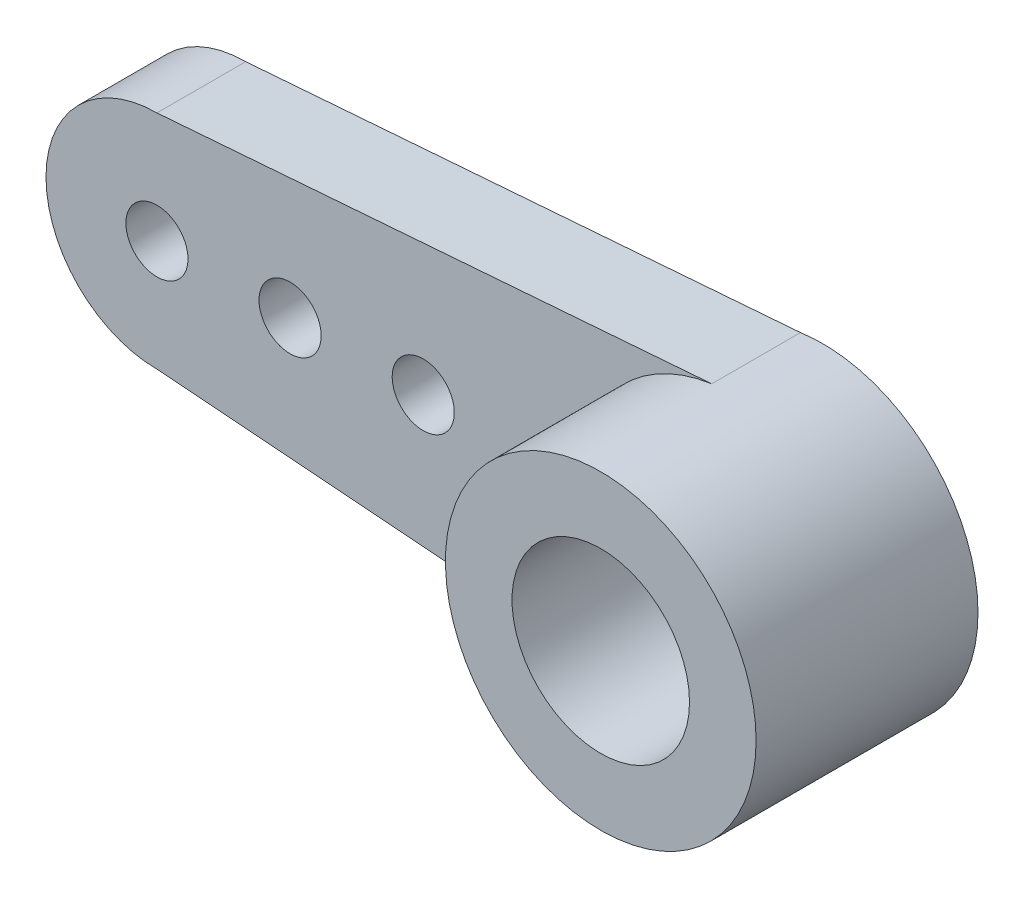
from build123d import *

# Parameters (mm, degrees)
SKETCH1_R           = 3.5
SKETCH1_R_2         = 2
BOSS_EXTRUDE1_DEPTH = 5
SKETCH2_R           = 2
SKETCH2_R_2         = 0.7
BOSS_EXTRUDE2_DEPTH = 2


with BuildPart() as part:
    # Sketch1 → Boss-Extrude1 (new body)
    with BuildSketch(Plane.XY):
        Circle(SKETCH1_R)
        Circle(SKETCH1_R_2, mode=Mode.SUBTRACT)
    extrude(amount=BOSS_EXTRUDE1_DEPTH)

    # Sketch2 → Boss-Extrude2 (add)
    with BuildSketch(Plane(origin=(0, 0, 0), x_dir=(-1, 0, 0), z_dir=(0, 0, -1))):
        with BuildLine():
            Line((0.499445817, 3.464181559), (13, 2.5))
            ThreePointArc((13, 2.5), (15.5, 0), (13, -2.5))
            Line((13, -2.5), (0.499445817, -3.464181559))
            ThreePointArc((0.499445817, -3.464181559), (-3.5, 0), (0.499445817, 3.464181559))
        make_face()
        with Locations(Location((0, 0, 0), (0, 0, 180))):
            Circle(SKETCH2_R, mode=Mode.SUBTRACT)
        with Locations((7, 0)):
            Circle(SKETCH2_R_2, mode=Mode.SUBTRACT)
        with Locations((10, 0)):
            Circle(SKETCH2_R_2, mode=Mode.SUBTRACT)
        with Locations((13, 0)):
            Circle(SKETCH2_R_2, mode=Mode.SUBTRACT)
    extrude(amount=-BOSS_EXTRUDE2_DEPTH)


solid = part.part
